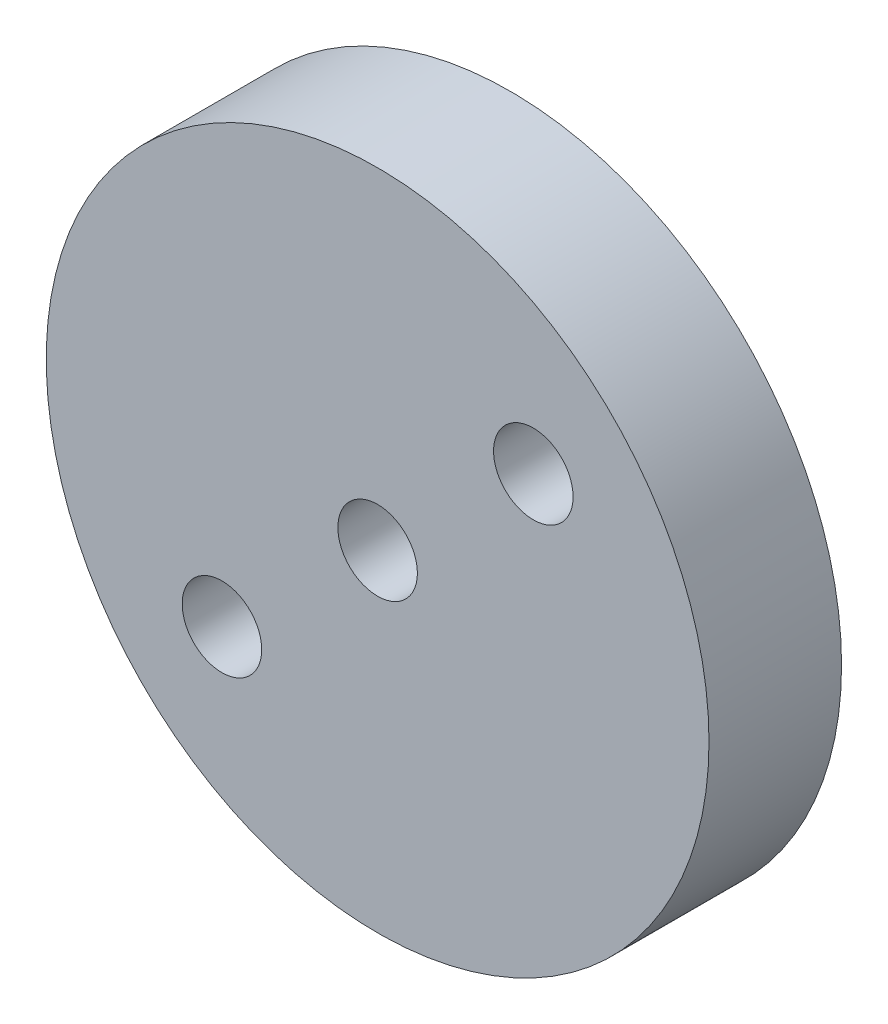
from build123d import *

# Parameters (mm, degrees)
SKETCH_1_R      = 12.5
SKETCH_1_R_2    = 1.5
EXTRUDE_1_DEPTH = 5


with BuildPart() as part:
    # 草图1 → 凸台-拉伸1 (new body)
    with BuildSketch(Plane.XY):
        Circle(SKETCH_1_R)
        Circle(SKETCH_1_R_2, mode=Mode.SUBTRACT)
        with Locations((-5.872415132, -5.432747051)):
            Circle(SKETCH_1_R_2, mode=Mode.SUBTRACT)
        with Locations((5.872415132, 5.432747051)):
            Circle(SKETCH_1_R_2, mode=Mode.SUBTRACT)
    extrude(amount=EXTRUDE_1_DEPTH)


solid = part.part
